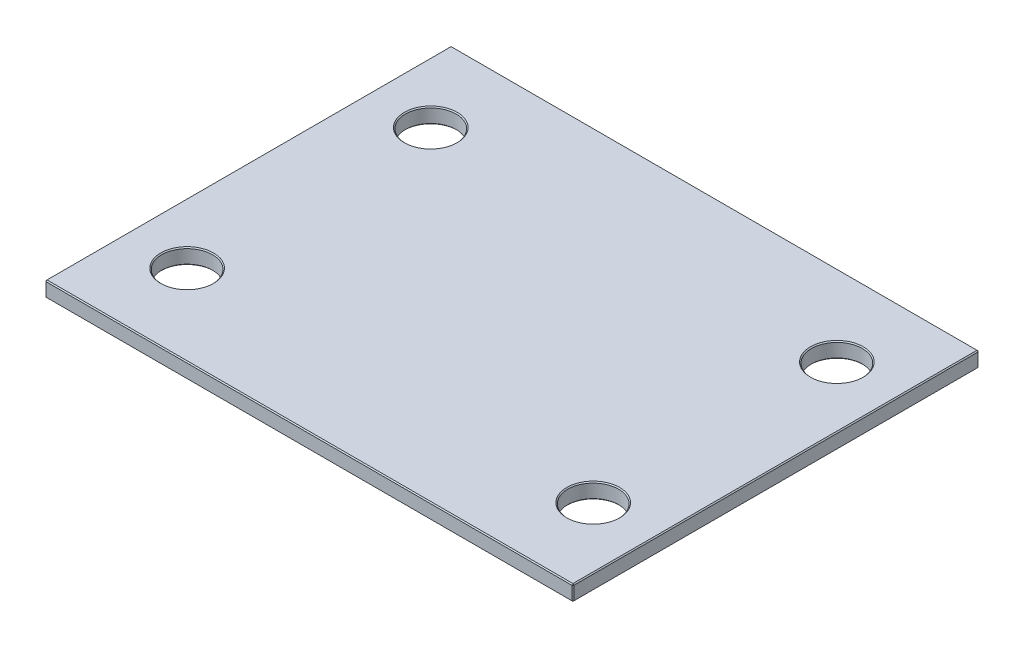
from build123d import *

# Parameters (mm, degrees)
SKETCH1_W           = 52
SKETCH1_H           = 40
SKETCH1_R           = 2.5
BOSS_EXTRUDE1_DEPTH = 1.524
CHAMFER1_SIZE       = 0.1


with BuildPart() as part:
    # Sketch1 → Boss-Extrude1 (new body)
    with BuildSketch(Plane(origin=(0, 0, 0), x_dir=(1, 0, 0), z_dir=(0, 1, 0))):
        Rectangle(SKETCH1_W, SKETCH1_H)
        with Locations(Location((-20, 12, 0), (0, 0, 90))):
            Circle(SKETCH1_R, mode=Mode.SUBTRACT)
        with Locations(Location((20, 12, 0), (0, 0, 90))):
            Circle(SKETCH1_R, mode=Mode.SUBTRACT)
        with Locations(Location((20, -12, 0), (0, 0, 90))):
            Circle(SKETCH1_R, mode=Mode.SUBTRACT)
        with Locations(Location((-20, -12, 0), (0, 0, 90))):
            Circle(SKETCH1_R, mode=Mode.SUBTRACT)
    extrude(amount=BOSS_EXTRUDE1_DEPTH)

    # Chamfer1
    chamfer1_edges = [part.edges().sort_by_distance(p)[0] for p in [
        (-20, 0, -9.5),
        (-20, 1.524, -9.5),
        (-26, 1.524, 0),
        (20, 0, -9.5),
        (20, 1.524, -9.5),
        (0, 1.524, 20),
        (20, 0, 14.5),
        (20, 1.524, 14.5),
        (-20, 0, 14.5),
        (-20, 1.524, 14.5),
        (26, 1.524, 0),
        (0, 0, 20),
        (-26, 0, 0),
        (0, 0, -20),
        (26, 0, 0),
        (26, 0.762, 20),
        (-26, 0.762, 20),
        (-26, 0.762, -20),
        (26, 0.762, -20),
        (0, 1.524, -20),
    ]]
    chamfer(chamfer1_edges, length=CHAMFER1_SIZE)


solid = part.part
